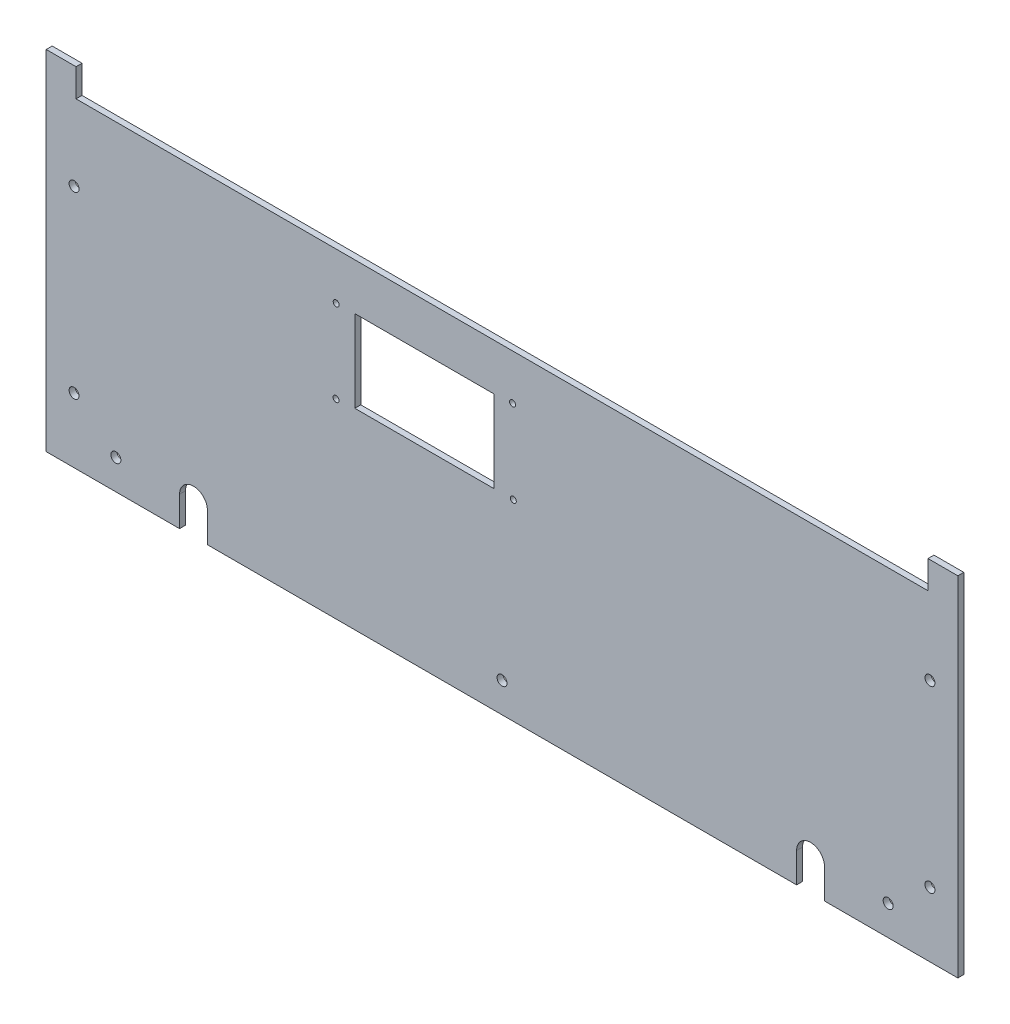
from build123d import *

# Parameters (mm, degrees)
SKETCH1_W           = 458
SKETCH1_H           = 245
BOSS_EXTRUDE1_DEPTH = 3
CUT_EXTRUDE1_DEPTH  = 260.723410574
SKETCH3_R           = 2.5
CUT_EXTRUDE2_DEPTH  = 260.723410574
SKETCH4_R           = 11.5
CUT_EXTRUDE3_DEPTH  = 260.723410574
SKETCH5_W           = 428
SKETCH5_H           = 29
CUT_EXTRUDE4_DEPTH  = 260.723410574
SKETCH8_R           = 1.5
SKETCH8_W           = 69.9
SKETCH8_H           = 41.2
CUT_EXTRUDE5_DEPTH  = 260.723410574
SKETCH9_W           = 458
SKETCH9_H           = 70
CUT_EXTRUDE6_DEPTH  = 10


with BuildPart() as part:
    # Sketch1 → Boss-Extrude1 (new body)
    with BuildSketch(Plane.XY):
        Rectangle(SKETCH1_W, SKETCH1_H)
    extrude(amount=BOSS_EXTRUDE1_DEPTH)

    # Sketch2 → Cut-Extrude1 (cut, through all)
    with BuildSketch(Plane.XY.offset(3)):
        with BuildLine():
            Line((-148, -107.5), (-148, -122.5))
            ThreePointArc((-148, -122.5), (-155, -129.5), (-162, -122.5))
            Line((-162, -122.5), (-162, -107.5))
            ThreePointArc((-162, -107.5), (-155, -100.5), (-148, -107.5))
        make_face()
        with BuildLine():
            Line((162, -107.5), (162, -122.5))
            ThreePointArc((162, -122.5), (155, -129.5), (148, -122.5))
            Line((148, -122.5), (148, -107.5))
            ThreePointArc((148, -107.5), (155, -100.5), (162, -107.5))
        make_face()
    extrude(amount=-CUT_EXTRUDE1_DEPTH, mode=Mode.SUBTRACT)

    # Sketch3 → Cut-Extrude2 (cut, through all)
    with BuildSketch(Plane.XY.offset(3)):
        with Locations((-194, 112.5)):
            Circle(SKETCH3_R)
        with Locations((-194, -107.5)):
            Circle(SKETCH3_R)
        with Locations((194, -107.5)):
            Circle(SKETCH3_R)
        with Locations((194, 112.5)):
            Circle(SKETCH3_R)
        with Locations((-215, 0)):
            Circle(SKETCH3_R)
        with Locations((-215, -90)):
            Circle(SKETCH3_R)
        with Locations((-215, 90)):
            Circle(SKETCH3_R)
        with Locations((215, 0)):
            Circle(SKETCH3_R)
        with Locations((215, -90)):
            Circle(SKETCH3_R)
        with Locations((215, 90)):
            Circle(SKETCH3_R)
        with Locations((0, 112.5)):
            Circle(SKETCH3_R)
        with Locations((0, -107.5)):
            Circle(SKETCH3_R)
    extrude(amount=-CUT_EXTRUDE2_DEPTH, mode=Mode.SUBTRACT)

    # Sketch4 → Cut-Extrude3 (cut, through all)
    with BuildSketch(Plane.XY.offset(3)):
        with Locations((-39, 91)):
            Circle(SKETCH4_R)
        with Locations((39, 91)):
            Circle(SKETCH4_R)
    extrude(amount=-CUT_EXTRUDE3_DEPTH, mode=Mode.SUBTRACT)

    # Sketch5 → Cut-Extrude4 (cut, through all)
    with BuildSketch(Plane.XY.offset(3)):
        with Locations((0, 53)):
            Rectangle(SKETCH5_W, SKETCH5_H)
    extrude(amount=-CUT_EXTRUDE4_DEPTH, mode=Mode.SUBTRACT)

    # Sketch8 → Cut-Extrude5 (cut, through all)
    with BuildSketch(Plane.XY.offset(3)):
        with Locations((5.296172264, 15.703565509)):
            Circle(SKETCH8_R)
        with Locations((5.679687501, -26.054673392)):
            Circle(SKETCH8_R)
        with Locations((-83.3, 14.88)):
            Circle(SKETCH8_R)
        with Locations((-83.367997673, -26.737946691)):
            Circle(SKETCH8_R)
        with Locations((-39, -5.5)):
            Rectangle(SKETCH8_W, SKETCH8_H)
    extrude(amount=-CUT_EXTRUDE5_DEPTH, mode=Mode.SUBTRACT)

    # Sketch9 → Cut-Extrude6 (cut)
    with BuildSketch(Plane.XY.offset(3)):
        with Locations((0, 87.5)):
            Rectangle(SKETCH9_W, SKETCH9_H)
    extrude(amount=-CUT_EXTRUDE6_DEPTH, mode=Mode.SUBTRACT)


solid = part.part
